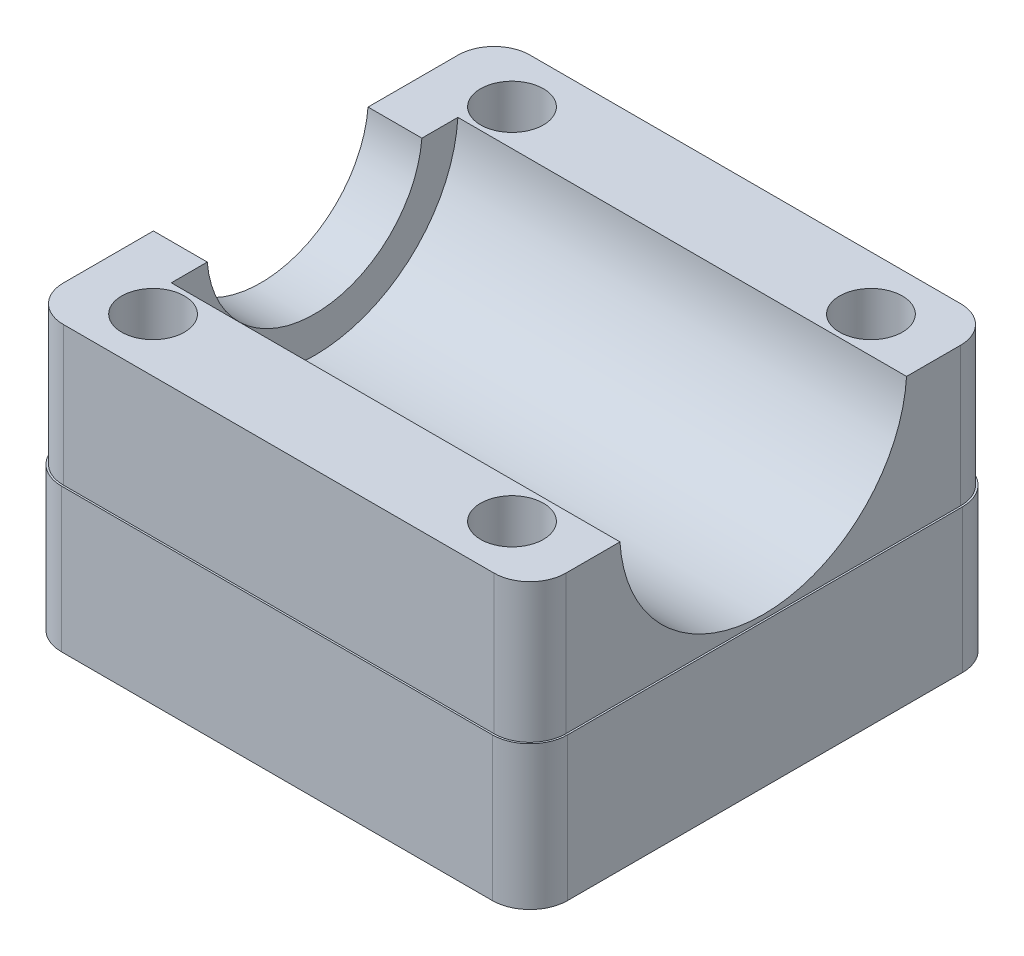
from build123d import *

# Parameters (mm, degrees)
SKETCH1_W           = 26
SKETCH1_H           = 32.5
SKETCH1_R           = 8
BOSS_EXTRUDE1_DEPTH = 14
SKETCH2_R           = 1.75
CUT_EXTRUDE1_DEPTH  = 72
SKETCH3_W           = 26
SKETCH3_H           = 16.75
CUT_EXTRUDE3_DEPTH  = 32
FILLET2_R           = 2
BOSS_EXTRUDE2_DEPTH = 3
CUT_EXTRUDE4_DEPTH  = 3
BOSS_EXTRUDE3_DEPTH = 8
CUT_EXTRUDE5_DEPTH  = 3
CUT_EXTRUDE6_DEPTH  = 25.010414407


with BuildPart() as part:
    # Sketch1 → Boss-Extrude1 (new, symmetric)
    with BuildSketch(Plane(origin=(0, 0, 0), x_dir=(0, 0, -1), z_dir=(1, 0, 0))):
        Rectangle(SKETCH1_W, SKETCH1_H)
        Circle(SKETCH1_R, mode=Mode.SUBTRACT)
    extrude(amount=BOSS_EXTRUDE1_DEPTH, both=True)

    # Sketch2 → Cut-Extrude1 (cut)
    with BuildSketch(Plane(origin=(0, 16.25, 0), x_dir=(1, 0, 0), z_dir=(0, 1, 0))):
        with Locations(Location((-10, 10, 0), (0, 0, 270))):
            Circle(SKETCH2_R)
        with Locations(Location((10, 10, 0), (0, 0, 270))):
            Circle(SKETCH2_R)
        with Locations(Location((10, -10, 0), (0, 0, 270))):
            Circle(SKETCH2_R)
        with Locations(Location((-10, -10, 0), (0, 0, 270))):
            Circle(SKETCH2_R)
    extrude(amount=-CUT_EXTRUDE1_DEPTH, mode=Mode.SUBTRACT)

    # Sketch3 → Cut-Extrude3 (cut)
    with BuildSketch(Plane.ZY.offset(14)):
        with Locations((0, 7.875)):
            Rectangle(SKETCH3_W, SKETCH3_H)
    extrude(amount=-CUT_EXTRUDE3_DEPTH, mode=Mode.SUBTRACT)

    # Fillet2
    fillet2_edges = [part.edges().sort_by_distance(p)[0] for p in [
        (-14, -8.375, 13),
        (14, -8.375, 13),
        (14, -8.375, -13),
        (-14, -8.375, -13),
    ]]
    fillet(fillet2_edges, radius=FILLET2_R)

    # Sketch4 → Boss-Extrude2 (add)
    with BuildSketch(Plane(origin=(-14, 0, 0), x_dir=(0, 0, -1), z_dir=(1, 0, 0))):
        with BuildLine():
            Line((-7.984359711, -0.5), (-5.979130372, -0.5))
            ThreePointArc((-5.979130372, -0.5), (0, -6), (5.979130372, -0.5))
            Line((5.979130372, -0.5), (7.984359711, -0.5))
            ThreePointArc((7.984359711, -0.5), (0, -8), (-7.984359711, -0.5))
        make_face()
    extrude(amount=BOSS_EXTRUDE2_DEPTH)

    # Sketch5 → Cut-Extrude4 (cut)
    with BuildSketch(Plane.XZ.offset(16.25)):
        Polygon((-6.593633412, 10), (-8.296816706, 12.95), (-11.703183294, 12.95), (-13.406366588, 10), (-11.703183294, 7.05), (-8.296816706, 7.05), align=None)
        Polygon((8.41228676, 6.85), (6.824573519, 10), (8.41228676, 12.75), (11.58771324, 12.75), (13.175426481, 10), (11.58771324, 6.85), align=None)
        Polygon((6.824573519, -10), (8.41228676, -12.75), (11.58771324, -12.75), (13.175426481, -10), (11.58771324, -7.25), (8.41228676, -7.25), align=None)
        Polygon((-8.41228676, -7.25), (-6.824573519, -10), (-8.41228676, -12.75), (-11.58771324, -12.75), (-13.175426481, -10), (-11.58771324, -7.25), align=None)
    extrude(amount=-CUT_EXTRUDE4_DEPTH, mode=Mode.SUBTRACT)

    # Sketch6 → Boss-Extrude3 (add)
    with BuildSketch(Plane.XZ.offset(16.25)):
        with BuildLine():
            Line((-12, -15.5), (12, -15.5))
            ThreePointArc((12, -15.5), (15.181980515, -14.181980515), (16.5, -11))
            Line((16.5, -11), (16.5, 11))
            ThreePointArc((16.5, 11), (15.181980515, 14.181980515), (12, 15.5))
            Line((12, 15.5), (-12, 15.5))
            ThreePointArc((-12, 15.5), (-15.181980515, 14.181980515), (-16.5, 11))
            Line((-16.5, 11), (-16.5, -11))
            ThreePointArc((-16.5, -11), (-15.181980515, -14.181980515), (-12, -15.5))
        make_face()
        with BuildLine():
            Line((-12, -13), (12, -13))
            ThreePointArc((12, -13), (13.414213562, -12.414213562), (14, -11))
            Line((14, -11), (14, 11))
            ThreePointArc((14, 11), (13.414213562, 12.414213562), (12, 13))
            Line((12, 13), (-12, 13))
            ThreePointArc((-12, 13), (-13.414213562, 12.414213562), (-14, 11))
            Line((-14, 11), (-14, -11))
            ThreePointArc((-14, -11), (-13.414213562, -12.414213562), (-12, -13))
        make_face(mode=Mode.SUBTRACT)
    extrude(amount=-BOSS_EXTRUDE3_DEPTH)

    # Sketch7 → Cut-Extrude5 (cut)
    with BuildSketch(Plane.XZ.offset(16.25)):
        Polygon((-6.593633412, 10), (-8.296816706, 12.95), (-11.703183294, 12.95), (-13.406366588, 10), (-11.703183294, 7.05), (-8.296816706, 7.05), align=None)
        Polygon((13.406366588, 10), (11.703183294, 12.95), (8.296816706, 12.95), (6.593633412, 10), (8.296816706, 7.05), (11.703183294, 7.05), align=None)
        Polygon((-6.593633412, -10), (-8.296816706, -7.05), (-11.703183294, -7.05), (-13.406366588, -10), (-11.703183294, -12.95), (-8.296816706, -12.95), align=None)
        Polygon((13.406366588, -10), (11.703183294, -7.05), (8.296816706, -7.05), (6.593633412, -10), (8.296816706, -12.95), (11.703183294, -12.95), align=None)
    extrude(amount=-CUT_EXTRUDE5_DEPTH, mode=Mode.SUBTRACT)

    # Sketch8 → Cut-Extrude6 (cut, through all)
    with BuildSketch(Plane(origin=(0, -8.25, 0), x_dir=(1, 0, 0), z_dir=(0, 1, 0))):
        with BuildLine():
            Line((-12, -15.7), (12, -15.7))
            ThreePointArc((12, -15.7), (15.323401872, -14.323401872), (16.7, -11))
            Line((16.7, -11), (16.7, 11))
            ThreePointArc((16.7, 11), (15.323401872, 14.323401872), (12, 15.7))
            Line((12, 15.7), (-12, 15.7))
            ThreePointArc((-12, 15.7), (-15.323401872, 14.323401872), (-16.7, 11))
            Line((-16.7, 11), (-16.7, -11))
            ThreePointArc((-16.7, -11), (-15.323401872, -14.323401872), (-12, -15.7))
        make_face()
        with BuildLine():
            Line((-14.1, 11), (-14.1, -11))
            ThreePointArc((-14.1, -11), (-13.48492424, -12.48492424), (-12, -13.1))
            Line((-12, -13.1), (12, -13.1))
            ThreePointArc((12, -13.1), (13.48492424, -12.48492424), (14.1, -11))
            Line((14.1, -11), (14.1, 11))
            ThreePointArc((14.1, 11), (13.48492424, 12.48492424), (12, 13.1))
            Line((12, 13.1), (-12, 13.1))
            ThreePointArc((-12, 13.1), (-13.48492424, 12.48492424), (-14.1, 11))
        make_face(mode=Mode.SUBTRACT)
    extrude(amount=-CUT_EXTRUDE6_DEPTH, mode=Mode.SUBTRACT)


solid = part.part
